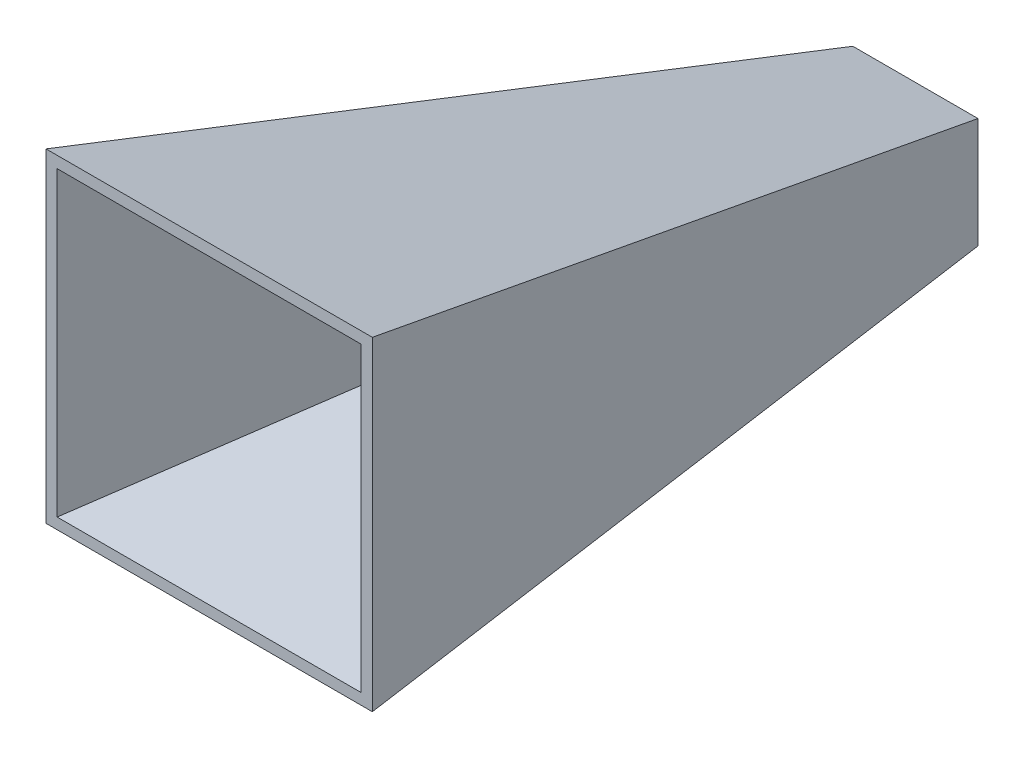
from build123d import *

# Parameters (mm, degrees)
SKETCH1_W           = 140.843
SKETCH1_H           = 139.954
BOSS_EXTRUDE1_DEPTH = 304.8
CUT_EXTRUDE1_DEPTH  = 364.767663166
CUT_EXTRUDE2_DEPTH  = 364.767663166
SHELL1_T            = -4.7625


with BuildPart() as part:
    # Sketch1 → Boss-Extrude1 (new body)
    with BuildSketch(Plane.XY):
        with Locations((70.4215, 69.977)):
            Rectangle(SKETCH1_W, SKETCH1_H)
    extrude(amount=BOSS_EXTRUDE1_DEPTH)

    # Sketch2 → Cut-Extrude1 (cut, through all)
    with BuildSketch(Plane(origin=(140.843, 0, 0), x_dir=(0, 0, -1), z_dir=(1, 0, 0))):
        Polygon((-304.8, 139.954), (0, 47.625), (0, 139.954), align=None)
    extrude(amount=-CUT_EXTRUDE1_DEPTH, mode=Mode.SUBTRACT)

    # Sketch3 → Cut-Extrude2 (cut, through all)
    with BuildSketch(Plane.XZ):
        Polygon((140.843, 304.8), (97.4344, 0), (140.843, 0), align=None)
        Polygon((0, 304.8), (43.4086, 0), (0, 0), align=None)
    extrude(amount=-CUT_EXTRUDE2_DEPTH, mode=Mode.SUBTRACT)

    # Shell1
    shell1_openings = [part.faces().sort_by_distance(p)[0] for p in [
        (70.4215, 69.977, 304.8),
        (70.4215, 23.8125, 0),
    ]]
    offset(amount=SHELL1_T, openings=shell1_openings, kind=Kind.INTERSECTION)


solid = part.part
